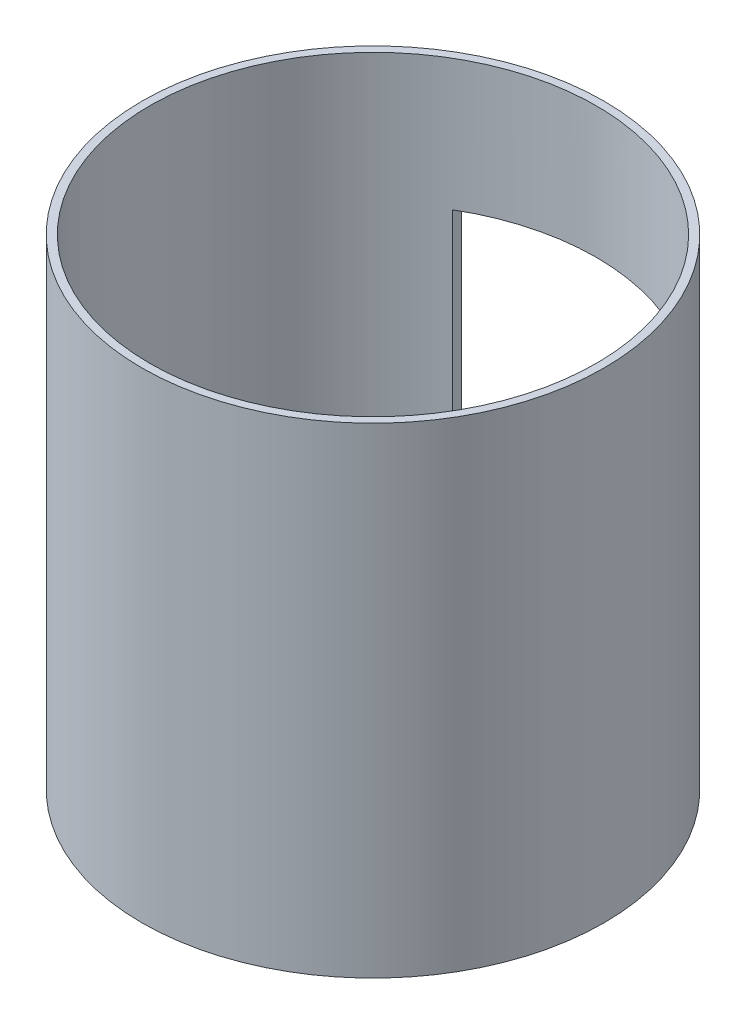
from build123d import *

# Parameters (mm, degrees)
SKETCH_1_R          = 85
EXTRUDE_1_DEPTH     = 180
SHELL_1_T           = 3
SKETCH_2_W          = 86
SKETCH_2_H          = 110
CUT_EXTRUDE_1_DEPTH = 180
SKETCH_3_W          = 47
SKETCH_3_H          = 47
EXTRUDE_2_DEPTH     = 40
SKETCH_4_W          = 55.017876713
SKETCH_4_H          = 12
CUT_EXTRUDE_3_DEPTH = 3


with BuildPart() as part:
    # 草图1 → 凸台-拉伸1 (new body)
    with BuildSketch(Plane(origin=(0, 0, 0), x_dir=(1, 0, 0), z_dir=(0, 1, 0))):
        with Locations(Location((0, 0, 0), (0, 0, 90))):
            Circle(SKETCH_1_R)
    extrude(amount=EXTRUDE_1_DEPTH)

    # 抽壳1
    shell_1_openings = [part.faces().sort_by_distance(p)[0] for p in [
        (0, 180, 0),
    ]]
    offset(amount=SHELL_1_T, openings=shell_1_openings, kind=Kind.INTERSECTION)

    # 草图2 → 切除-拉伸1 (cut)
    with BuildSketch(Plane.XY):
        with Locations((0, 75)):
            Rectangle(SKETCH_2_W, SKETCH_2_H)
    extrude(amount=-CUT_EXTRUDE_1_DEPTH, mode=Mode.SUBTRACT)

    # 草图3 → 凸台-拉伸2 (add)
    with BuildSketch(Plane(origin=(0, 0, 0), x_dir=(1, 0, 0), z_dir=(0, 1, 0))):
        Polygon((0, 25), (25, 25), (25, -25), (-25, -25), (-25, 25), align=None)
        Rectangle(SKETCH_3_W, SKETCH_3_H, mode=Mode.SUBTRACT)
    extrude(amount=EXTRUDE_2_DEPTH)

    # 草图4 → 切除-拉伸3 (cut)
    with BuildSketch(Plane(origin=(25, 0, 0), x_dir=(0, 0, -1), z_dir=(1, 0, 0))):
        with Locations((-0.083732348, 4.206538913)):
            Rectangle(SKETCH_4_W, SKETCH_4_H)
    extrude(amount=-CUT_EXTRUDE_3_DEPTH, mode=Mode.SUBTRACT)


solid = part.part
